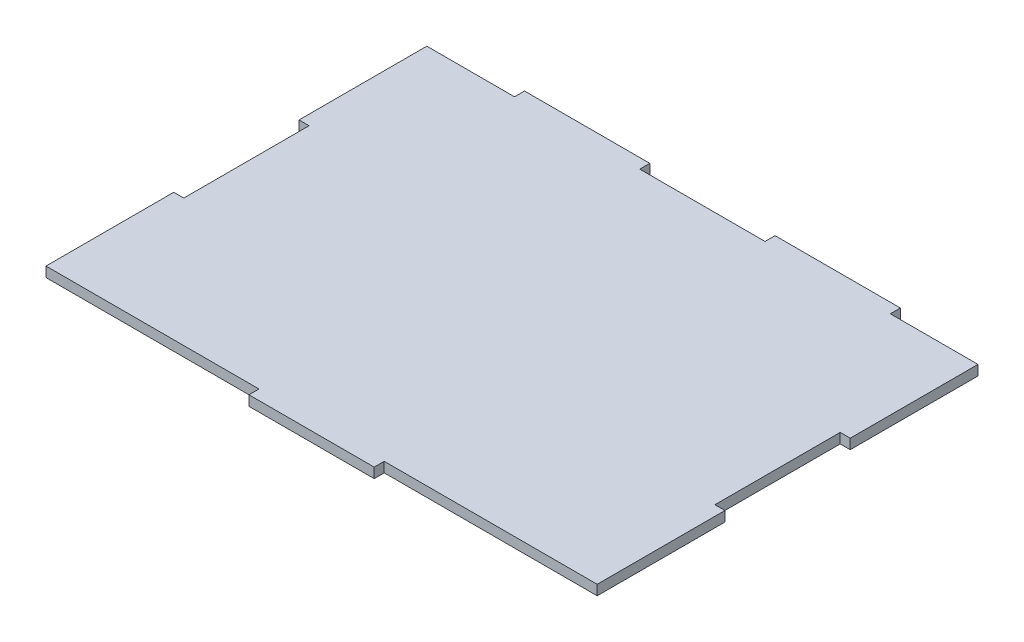
from build123d import *

# Parameters (mm, degrees)
BOSS_EXTRUDE1_DEPTH = 4


with BuildPart() as part:
    # Sketch3 → Boss-Extrude1 (new body)
    with BuildSketch(Plane(origin=(0, 0, 0), x_dir=(1, 0, 0), z_dir=(0, 1, 0))):
        Polygon((-110, 76), (-110, 25), (-106, 25), (-106, -25), (-110, -25), (-110, -76), (-25, -76), (-25, -80), (25, -80), (25, -76), (110, -76), (110, -25), (106, -25), (106, 25), (110, 25), (110, 76), (75, 76), (75, 80), (25, 80), (25, 76), (-25, 76), (-25, 80), (-75, 80), (-75, 76), align=None)
    extrude(amount=BOSS_EXTRUDE1_DEPTH)


solid = part.part
